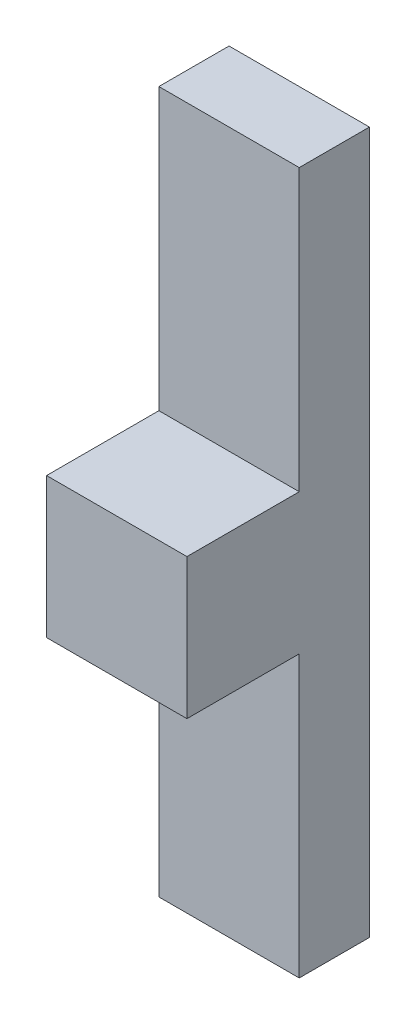
from build123d import *

# Parameters (mm, degrees)
SKETCH1_W           = 12.7
SKETCH1_H           = 63.5
BOSS_EXTRUDE1_DEPTH = 6.35
SKETCH2_W           = 12.7
SKETCH2_H           = 12.7
BOSS_EXTRUDE2_DEPTH = 10.16


with BuildPart() as part:
    # Sketch1 → Boss-Extrude1 (new body)
    with BuildSketch(Plane.XY):
        with Locations((-9.26915446, 0)):
            Rectangle(SKETCH1_W, SKETCH1_H)
    extrude(amount=BOSS_EXTRUDE1_DEPTH)

    # Sketch2 → Boss-Extrude2 (add)
    with BuildSketch(Plane.XY.offset(6.35)):
        with Locations((-9.26915446, 0)):
            Rectangle(SKETCH2_W, SKETCH2_H)
    extrude(amount=BOSS_EXTRUDE2_DEPTH)


solid = part.part
